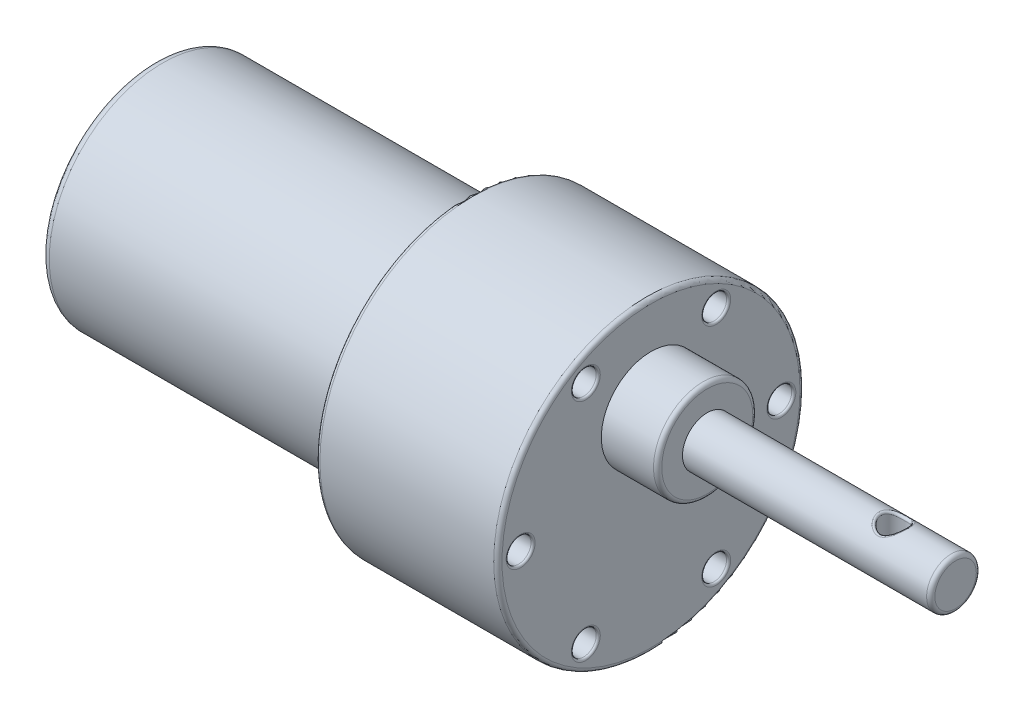
from build123d import *

# Parameters (mm, degrees)
SKETCH1_R           = 13.7
BOSS_EXTRUDE1_DEPTH = 38
FILLET1_R           = 1
SKETCH2_R           = 18.5
BOSS_EXTRUDE2_DEPTH = 22
FILLET2_R           = 0.5
SKETCH3_R           = 6
BOSS_EXTRUDE3_DEPTH = 6.8
SKETCH4_R           = 3
BOSS_EXTRUDE4_DEPTH = 30
SKETCH5_R           = 1.5
CUT_EXTRUDE1_DEPTH  = 15
FILLET3_R           = 0.5
CUT_EXTRUDE2_REACH  = 102.273
SKETCH6_R           = 1.5
SKETCH7_R           = 1
SKETCH7_W           = 1
SKETCH7_H           = 2.5
BOSS_EXTRUDE5_DEPTH = 2
FILLET4_R           = 1
SKETCH8_R           = 0.5
CUT_EXTRUDE3_DEPTH  = 1
CUT_EXTRUDE4_START  = -1
SKETCH9_R           = 0.5
CUT_EXTRUDE4_DEPTH  = 1
FILLET5_R           = 0.25
FILLET6_R           = 0.25


with BuildPart() as part:
    # Sketch1 → Boss-Extrude1 (new body)
    with BuildSketch(Plane(origin=(0, 0, 0), x_dir=(0, 0, -1), z_dir=(1, 0, 0))):
        Circle(SKETCH1_R)
    extrude(amount=BOSS_EXTRUDE1_DEPTH)

    # Fillet1
    fillet1_edges = [part.edges().sort_by_distance(p)[0] for p in [
        (0, 0, 13.7),
        (38, 0, 13.7),
    ]]
    fillet(fillet1_edges, radius=FILLET1_R)

    # Sketch2 → Boss-Extrude2 (add)
    with BuildSketch(Plane(origin=(38, 0, 0), x_dir=(0, 0, -1), z_dir=(1, 0, 0))):
        Circle(SKETCH2_R)
    extrude(amount=BOSS_EXTRUDE2_DEPTH)

    # Fillet2
    fillet2_edges = [part.edges().sort_by_distance(p)[0] for p in [
        (38, 0, 18.5),
        (60, 0, 18.5),
    ]]
    fillet(fillet2_edges, radius=FILLET2_R)

    # Sketch3 → Boss-Extrude3 (add)
    with BuildSketch(Plane(origin=(60, 0, 0), x_dir=(0, 0, -1), z_dir=(1, 0, 0))):
        with Locations((0, 7)):
            Circle(SKETCH3_R)
    extrude(amount=BOSS_EXTRUDE3_DEPTH)

    # Sketch4 → Boss-Extrude4 (add)
    with BuildSketch(Plane(origin=(66.8, 0, 0), x_dir=(0, 0, -1), z_dir=(1, 0, 0))):
        with Locations((0, 7)):
            Circle(SKETCH4_R)
    extrude(amount=BOSS_EXTRUDE4_DEPTH)

    # Sketch5 → Cut-Extrude1 (cut)
    with BuildSketch(Plane(origin=(60, 0, 0), x_dir=(0, 0, -1), z_dir=(1, 0, 0))):
        with Locations((15.75, 0)):
            Circle(SKETCH5_R)
        with Locations((7.875, -13.63990011)):
            Circle(SKETCH5_R)
        with Locations((-7.875, -13.63990011)):
            Circle(SKETCH5_R)
        with Locations((-15.75, 0)):
            Circle(SKETCH5_R)
        with Locations((-7.875, 13.63990011)):
            Circle(SKETCH5_R)
        with Locations((7.875, 13.63990011)):
            Circle(SKETCH5_R)
    extrude(amount=-CUT_EXTRUDE1_DEPTH, mode=Mode.SUBTRACT)

    # Fillet3
    fillet3_edges = [part.edges().sort_by_distance(p)[0] for p in [
        (66.8, 7, 6),
        (96.8, 7, 3),
    ]]
    fillet(fillet3_edges, radius=FILLET3_R)

    # Sketch6 → Cut-Extrude2 (cut, up to next)
    with BuildSketch(Plane(origin=(0, 0, 0), x_dir=(1, 0, 0), z_dir=(0, 1, 0)), mode=Mode.PRIVATE) as cut_extrude2_sk1:
        with Locations(Location((89.3, 0, 0), (0, 0, 90))):
            Circle(SKETCH6_R)
    cut_extrude2_tool1 = extrude(cut_extrude2_sk1.sketch, amount=CUT_EXTRUDE2_REACH, mode=Mode.PRIVATE) & part.part
    add(cut_extrude2_tool1.solids().sort_by_distance((89.3, 0, 0))[0], mode=Mode.SUBTRACT)

    # Sketch7 → Boss-Extrude5 (add)
    with BuildSketch(Plane.ZY):
        with Locations(Location((0, 0, 0), (0, 0, 180))):
            Circle(SKETCH7_R)
        with Locations((-10, 0)):
            Rectangle(SKETCH7_W, SKETCH7_H)
        with Locations((10, 0)):
            Rectangle(SKETCH7_W, SKETCH7_H)
    extrude(amount=BOSS_EXTRUDE5_DEPTH)

    # Fillet4
    fillet4_edges = [part.edges().sort_by_distance(p)[0] for p in [
        (-2, 0, 1),
    ]]
    fillet(fillet4_edges, radius=FILLET4_R)

    # Sketch8 → Cut-Extrude3 (cut)
    with BuildSketch(Plane.XY.offset(10.5)):
        with Locations((-1, 0)):
            Circle(SKETCH8_R)
    extrude(amount=-CUT_EXTRUDE3_DEPTH, mode=Mode.SUBTRACT)

    # Sketch9 → Cut-Extrude4 (cut)
    with BuildSketch(Plane(origin=(0, 0, -10.5), x_dir=(-1, 0, 0), z_dir=(0, 0, -1)).offset(CUT_EXTRUDE4_START)):
        with Locations(Location((1, 0, 0), (0, 0, 180))):
            Circle(SKETCH9_R)
    extrude(amount=CUT_EXTRUDE4_DEPTH, mode=Mode.SUBTRACT)

    # Fillet5
    fillet5_edges = [part.edges().sort_by_distance(p)[0] for p in [
        (89.299999998, 4.401923789, 1.5),
        (89.299999998, 9.598076211, 1.5),
    ]]
    fillet(fillet5_edges, radius=FILLET5_R)

    # Fillet6
    fillet6_edges = [part.edges().sort_by_distance(p)[0] for p in [
        (60, 0, -14.25),
        (60, 13.63990011, -6.375),
        (60, 13.63990011, 9.375),
        (60, 0, 17.25),
        (60, -13.63990011, 9.375),
        (60, -13.63990011, -6.375),
    ]]
    fillet(fillet6_edges, radius=FILLET6_R)


solid = part.part
